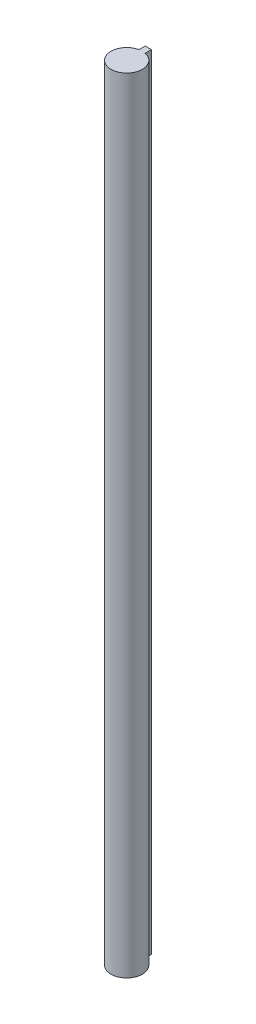
from build123d import *

# Parameters (mm, degrees)
EXTRUDE_1_DEPTH = 500


with BuildPart() as part:
    # 草图1 → 凸台-拉伸1 (new body)
    with BuildSketch(Plane(origin=(0, 0, 0), x_dir=(1, 0, 0), z_dir=(0, 1, 0))):
        with BuildLine():
            Line((-2, 9.797958971), (-2, 13.797958971))
            Line((-2, 13.797958971), (2, 13.797958971))
            Line((2, 13.797958971), (2, 9.797958971))
            ThreePointArc((2, 9.797958971), (0, -10), (-2, 9.797958971))
        make_face()
    extrude(amount=EXTRUDE_1_DEPTH)


solid = part.part
